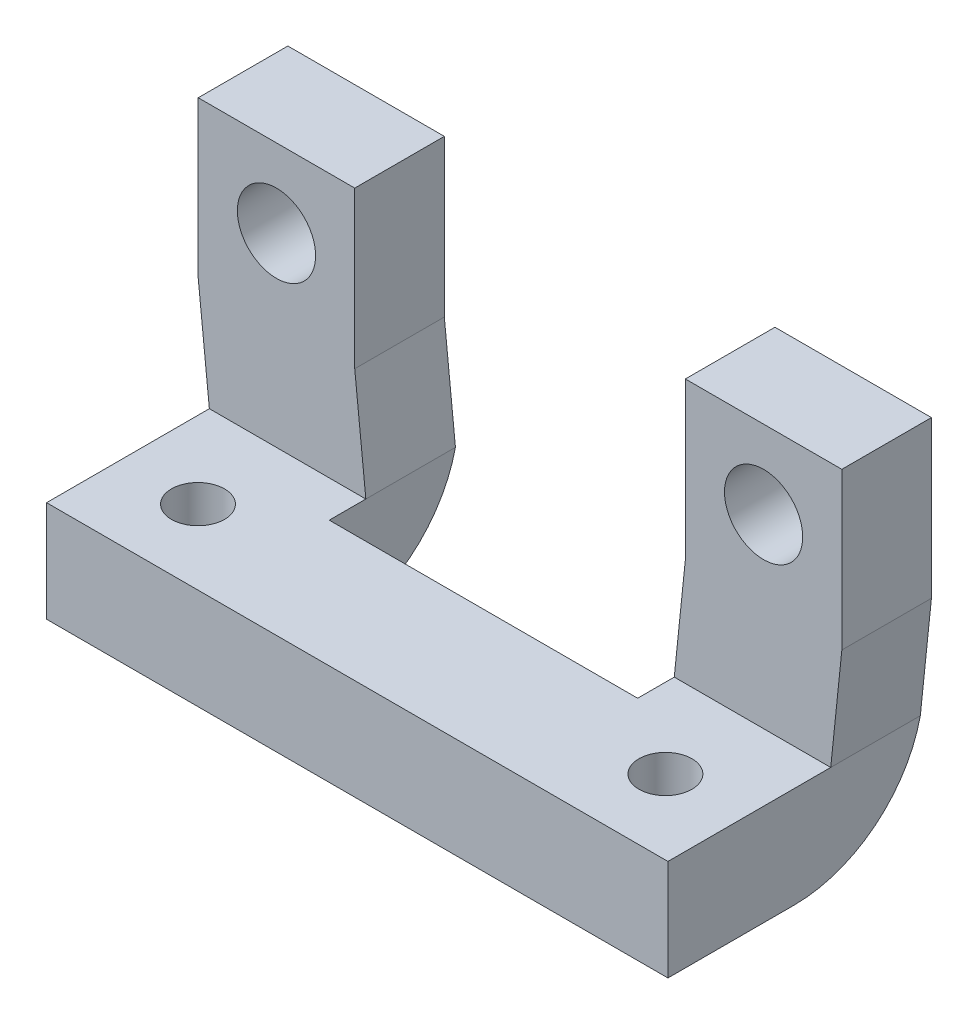
from build123d import *

# Parameters (mm, degrees)
SKETCH1_W             = 24.62
SKETCH1_H             = 5
SKETCH1_R             = 1.05
BOSS_EXTRUDE1_DEPTH   = 4
SKETCH2_R             = 1.55
BOSS_EXTRUDE2_DEPTH   = 5
BOSS_EXTRUDE2_2_DEPTH = 5
BOSS_EXTRUDE3_DEPTH   = 6.2
BOSS_EXTRUDE4_START   = -6.2
BOSS_EXTRUDE4_DEPTH   = 6.2
CUT_EXTRUDE1_REACH    = 32.969
SKETCH5_W             = 1.45
SKETCH5_H             = 10.45


with BuildPart() as part:
    # Sketch1 → Boss-Extrude1 (new body)
    with BuildSketch(Plane(origin=(0, 0, 0), x_dir=(1, 0, 0), z_dir=(0, 1, 0))):
        with Locations((0, 2.5)):
            Rectangle(SKETCH1_W, SKETCH1_H)
        with Locations(Location((-9.26, 2.95, 0), (0, 0, 270))):
            Circle(SKETCH1_R, mode=Mode.SUBTRACT)
        with Locations(Location((9.26, 2.95, 0), (0, 0, 270))):
            Circle(SKETCH1_R, mode=Mode.SUBTRACT)
    extrude(amount=BOSS_EXTRUDE1_DEPTH)



with BuildPart() as body_2:
    # Sketch2 → Boss-Extrude2 (new body)
    with BuildSketch(Plane(origin=(0, 0, -5), x_dir=(-1, 0, 0), z_dir=(0, 0, -1))):
        Polygon((-12.31, 4), (-12.75, 8.25), (-12.75, 14.45), (-6.55, 14.45), (-6.55, 8.25), (-6.11, 4), align=None)
        with Locations((-9.65, 11.35)):
            Circle(SKETCH2_R, mode=Mode.SUBTRACT)
    extrude(amount=BOSS_EXTRUDE2_DEPTH)


with BuildPart() as body_3:
    # Sketch2 → Boss-Extrude2 2 (new body)
    with BuildSketch(Plane(origin=(0, 0, -5), x_dir=(-1, 0, 0), z_dir=(0, 0, -1))):
        Polygon((6.11, 4), (6.55, 8.25), (6.55, 14.45), (12.75, 14.45), (12.75, 8.25), (12.31, 4), align=None)
        with Locations((9.65, 11.35)):
            Circle(SKETCH2_R, mode=Mode.SUBTRACT)
    extrude(amount=BOSS_EXTRUDE2_2_DEPTH)


with BuildPart() as part_1:
    add(part.part)

    add(body_2.part)  # Boss-Extrude3 merges body 2
    # Sketch6 → Boss-Extrude3 (add)
    with BuildSketch(Plane(origin=(12.31, 0, 0), x_dir=(0, 0, -1), z_dir=(1, 0, 0))):
        with BuildLine():
            Line((5, 0), (5, 4))
            Line((5, 4), (10, 4))
            ThreePointArc((10, 4), (8.201562119, 1.123047352), (5, 0))
        make_face()
    extrude(amount=-BOSS_EXTRUDE3_DEPTH)


    add(body_3.part)  # Boss-Extrude4 merges body 3
    # Sketch7 → Boss-Extrude4 (add)
    with BuildSketch(Plane.ZY.offset(12.31).offset(BOSS_EXTRUDE4_START)):
        with BuildLine():
            Line((-5, 4), (-5, 0))
            ThreePointArc((-5, 0), (-8.201562119, 1.123047352), (-10, 4))
            Line((-10, 4), (-5, 4))
        make_face()
    extrude(amount=BOSS_EXTRUDE4_DEPTH)

    # Cut-Extrude1: up to this face of the body (flat: up to its plane)
    cut_extrude1_end = Plane(part_1.part.faces().sort_by_distance((-12.75, 11.35, -7.5))[0])
    # Sketch5 → Cut-Extrude1 (cut, up to the picked face)
    with BuildSketch(Plane(origin=(12.75, 0, 0), x_dir=(0, 0, -1), z_dir=(1, 0, 0)), mode=Mode.PRIVATE) as cut_extrude1_sk1:
        with Locations((5.725, 9.225)):
            Rectangle(SKETCH5_W, SKETCH5_H)
    cut_extrude1_tool1 = split(extrude(cut_extrude1_sk1.sketch, amount=-CUT_EXTRUDE1_REACH, mode=Mode.PRIVATE), bisect_by=cut_extrude1_end, keep=Keep.BOTH, mode=Mode.PRIVATE)
    add(cut_extrude1_tool1.solids().sort_by(Axis((12.75, 9.225, -5.725), (-1, 0, 0)))[0], mode=Mode.SUBTRACT)


solid = part_1.part
